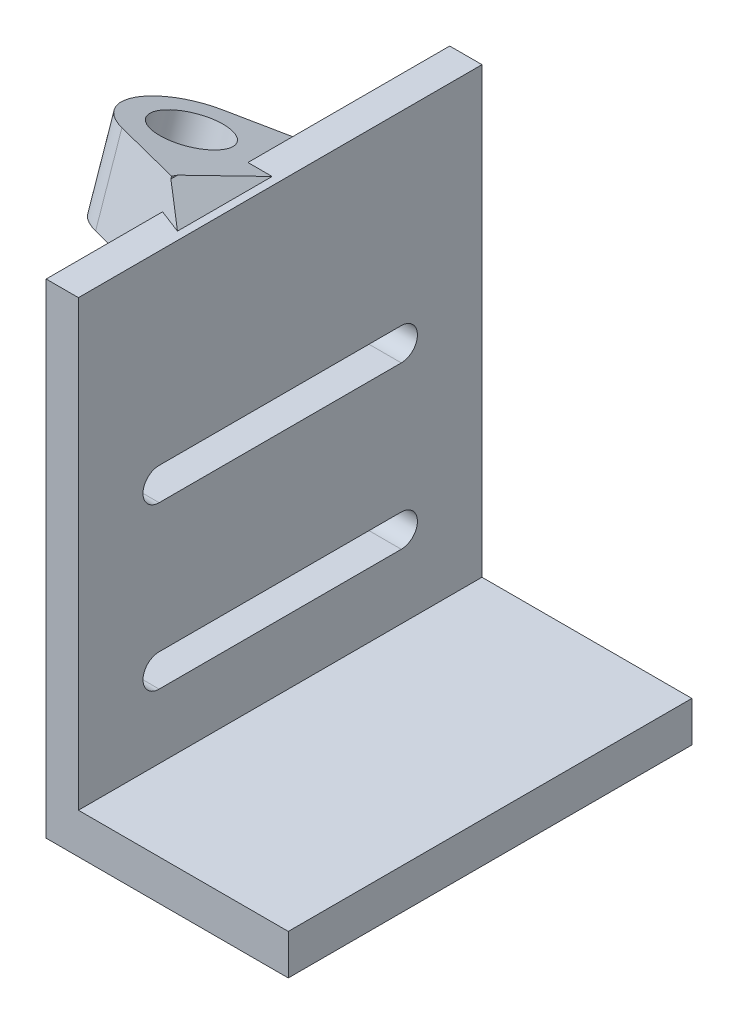
from build123d import *

# Parameters (mm, degrees)
RESSALTO_EXTRUS_O1_DEPTH = 50
CORTE_EXTRUS_O1_DEPTH    = 50
F_3DSKETCH1_R            = 4.15
RESSALTO_EXTRUS_O2_DEPTH = 10
CHANFRO1_SIZE            = 3


with BuildPart() as part:
    # Esboço2 → Ressalto-extrusão1 (new body)
    with BuildSketch(Plane.XY):
        Polygon((0, 0), (30, 0), (30, 5), (4, 5), (4, 60), (0, 60), align=None)
    extrude(amount=RESSALTO_EXTRUS_O1_DEPTH)

    # Esboço3 → Corte-extrusão1 (cut)
    with BuildSketch(Plane(origin=(4, 0, 0), x_dir=(0, 0, -1), z_dir=(1, 0, 0))):
        with BuildLine():
            Line((-40, 37), (-10, 37))
            ThreePointArc((-10, 37), (-8, 35), (-10, 33))
            Line((-10, 33), (-40, 33))
            ThreePointArc((-40, 33), (-42, 35), (-40, 37))
        make_face()
        with BuildLine():
            Line((-40, 17), (-10, 17))
            ThreePointArc((-10, 17), (-8, 15), (-10, 13))
            Line((-10, 13), (-40, 13))
            ThreePointArc((-40, 13), (-42, 15), (-40, 17))
        make_face()
    extrude(amount=-CORTE_EXTRUS_O1_DEPTH, mode=Mode.SUBTRACT)

    # 3DSketch1 → Ressalto-extrusão2 (add)
    with BuildSketch(Plane(origin=(-9.395973154, 62.141320747, 31.218847007), x_dir=(0.493101437864631, -0.2832351206870136, -0.8225745184390569), z_dir=(0, -0.9455185755993176, 0.3255681544571544))):
        with BuildLine():
            Line((0, 0), (1.65541197, 9.862028757))
            Line((1.65541197, 9.862028757), (19.05484842, 0))
            Line((19.05484842, 0), (11.443924645, -6.486435022))
            ThreePointArc((11.443924645, -6.486435022), (3.451710065, -7.248591137), (0, 0))
        make_face()
        with Locations(Location((6.90342013, -1.158788379, 0), (0, 0, 330.45536526))):
            Circle(F_3DSKETCH1_R, mode=Mode.SUBTRACT)
    extrude(amount=RESSALTO_EXTRUS_O2_DEPTH)

    # Chanfro1
    chanfro1_edges = [part.edges().sort_by_distance(p)[0] for p in [
        (0, 60, 30.288103406),
    ]]
    chamfer(chanfro1_edges, length=CHANFRO1_SIZE)


solid = part.part
